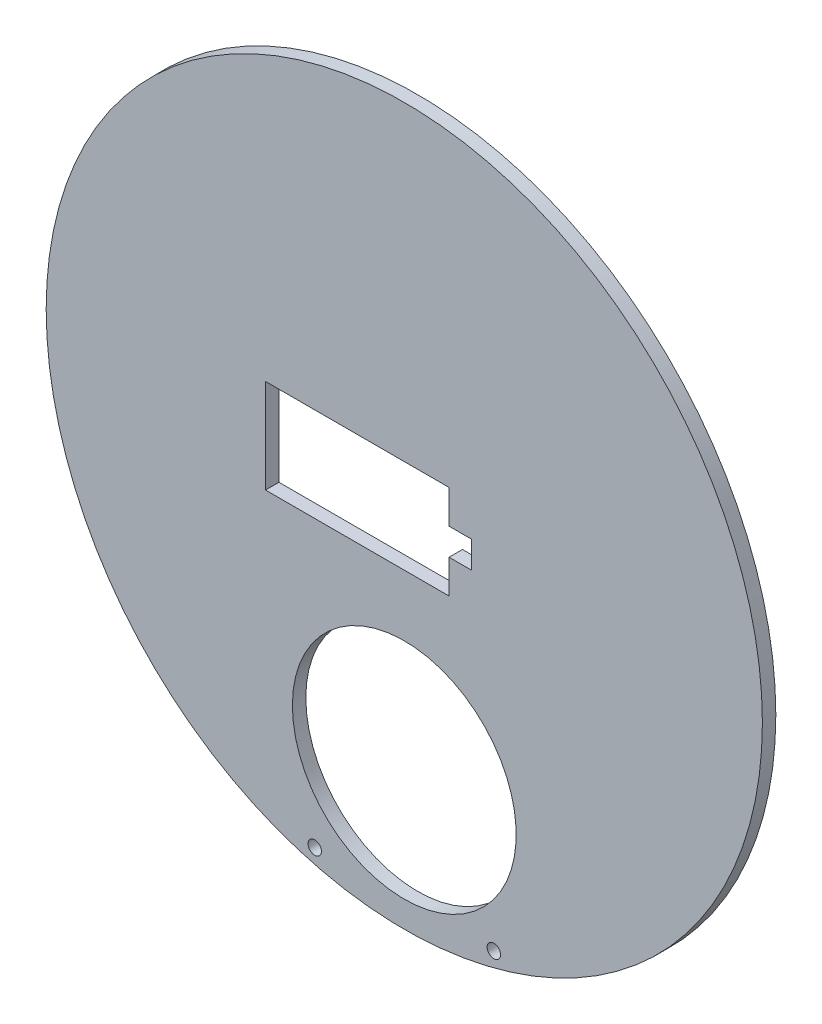
from build123d import *

# Parameters (mm, degrees)
ESQUISSE1_R              = 80
BOSS_EXTRU_1_DEPTH       = 3
ESQUISSE2_R              = 1
ENL_V_MAT_EXTRU_1_DEPTH  = 3
ESQUISSE3_R              = 1.5
ENL_V_MAT_EXTRU_10_DEPTH = 3


with BuildPart() as part:
    # Esquisse1 → Boss.-Extru.1 (new body)
    with BuildSketch(Plane.XY):
        with Locations((-11.197924537, 8.24446622)):
            Circle(ESQUISSE1_R)
    extrude(amount=BOSS_EXTRU_1_DEPTH)

    # Esquisse2 → Enlèv. mat.-Extru.1 (cut)
    # profile 1 of 2: a face of its own
    with BuildSketch(Plane(origin=(0, 0, 0), x_dir=(-1, 0, 0), z_dir=(0, 0, -1))):
        Polygon((-3.802075463, 11.24446622), (-3.802075463, 5.24446622), (1.197924537, 5.24446622), (1.197924537, -2.25553378), (42.197924537, -2.25553378), (42.197924537, 18.74446622), (1.197924537, 18.74446622), (1.197924537, 11.24446622), align=None)
        with Locations((11.197924537, 8.24446622)):
            Circle(ESQUISSE2_R, mode=Mode.SUBTRACT)
    # profile 2 of 2: a face of its own
    with BuildSketch(Plane(origin=(0, 0, 0), x_dir=(-1, 0, 0), z_dir=(0, 0, -1))):
        with Locations((11.197924537, 8.24446622)):
            Circle(ESQUISSE2_R)
    extrude(amount=-ENL_V_MAT_EXTRU_1_DEPTH, mode=Mode.SUBTRACT)

    # Esquisse3 → Enlèv. mat.-Extru.10 (cut)
    with BuildSketch(Plane(origin=(0, 0, 0), x_dir=(-1, 0, 0), z_dir=(0, 0, -1))):
        with BuildLine():
            ThreePointArc((36.197924537, -40.917518651), (28.875594067, -23.239849121), (11.197924537, -15.917518651))
            Line((11.197924537, -15.917518651), (11.197924537, -65.917518651))
            ThreePointArc((11.197924537, -65.917518651), (28.875594067, -58.59518818), (36.197924537, -40.917518651))
        make_face()
        with BuildLine():
            Line((11.197924537, -65.917518651), (11.197924537, -15.917518651))
            ThreePointArc((11.197924537, -15.917518651), (-13.802075463, -40.917518651), (11.197924537, -65.917518651))
        make_face()
        with Locations((-8.802075463, -65.919884489)):
            Circle(ESQUISSE3_R)
        with Locations((31.197924537, -65.917518651)):
            Circle(ESQUISSE3_R)
    extrude(amount=-ENL_V_MAT_EXTRU_10_DEPTH, mode=Mode.SUBTRACT)


solid = part.part
